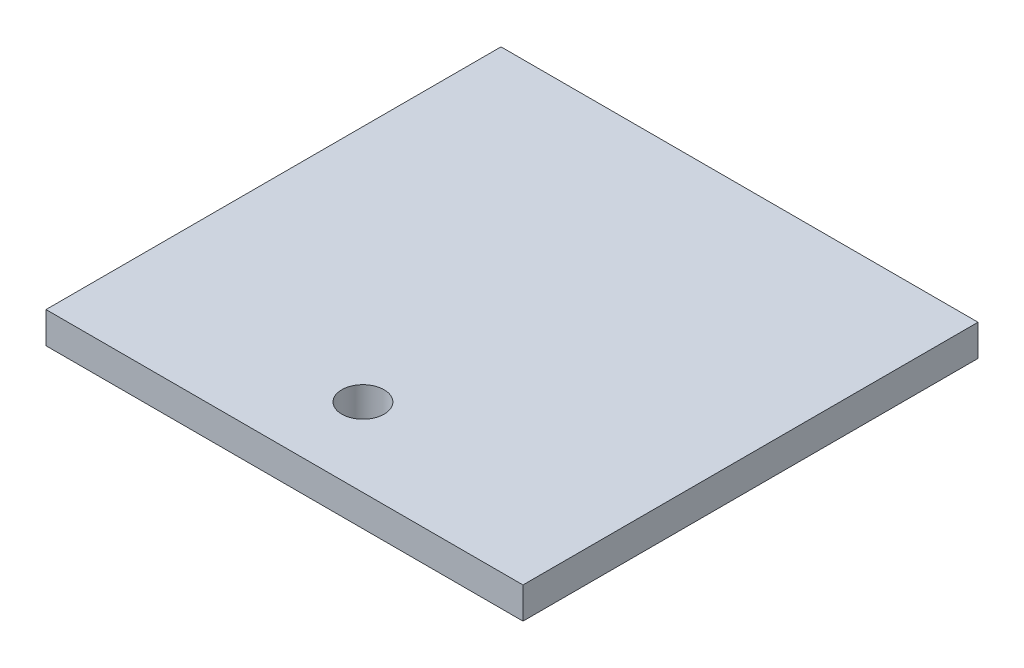
from build123d import *

# Parameters (mm, degrees)
SKETCH1_W           = 152
SKETCH1_H           = 145
BOSS_EXTRUDE1_DEPTH = 10
SKETCH2_R           = 6.75
CUT_EXTRUDE1_DEPTH  = 18


with BuildPart() as part:
    # Sketch1 → Boss-Extrude1 (new body)
    with BuildSketch(Plane(origin=(0, 0, 0), x_dir=(1, 0, 0), z_dir=(0, 1, 0))):
        Rectangle(SKETCH1_W, SKETCH1_H)
    extrude(amount=BOSS_EXTRUDE1_DEPTH)

    # Sketch2 → Cut-Extrude1 (cut)
    with BuildSketch(Plane(origin=(0, 0, 0), x_dir=(1, 0, 0), z_dir=(0, 1, 0))):
        with Locations(Location((0, -47.5, 0), (0, 0, 270))):
            Circle(SKETCH2_R)
    extrude(amount=CUT_EXTRUDE1_DEPTH, mode=Mode.SUBTRACT)


solid = part.part
